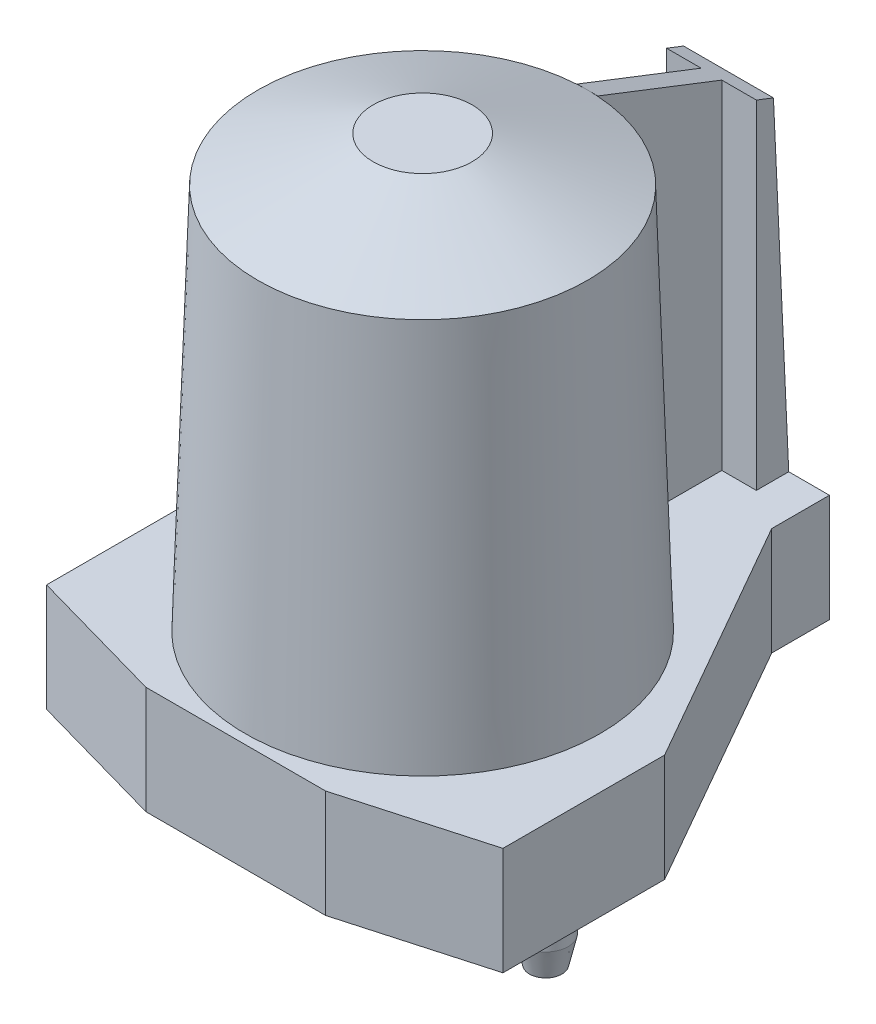
from build123d import *
from OCP.BRepFilletAPI import BRepFilletAPI_MakeChamfer

# Parameters (mm, degrees)
BOSS_EXTRU_1_DEPTH             = 6
BOSS_EXTRU_5_DEPTH             = 0.575
BOSS_EXTRU_6_REACH             = 39.159
ESQUISSE4_W                    = 0.275
ESQUISSE4_H                    = 6
BOSS_EXTRU_6_DIRECTION_2_REACH = 39.159
BOSS_EXTRU_7_DEPTH             = 2.5
ESQUISSE6_R                    = 1.25
BOSS_EXTRU_8_DEPTH             = 2.5
CHANFREIN1_SIZE                = 1.5
CHANFREIN1_SIZE2               = 0.346302287


with BuildPart() as part:
    # Esquisse1 → Boss.-Extru.1 (new body)
    with BuildSketch(Plane(origin=(0, 0, 0), x_dir=(1, 0, 0), z_dir=(0, 1, 0))):
        Polygon((5, -10.4), (-5, -10.4), (-12.7, -8.229746559), (-12.7, 0.770253441), (-4.765, 14.663984942), (-4.765, 17.6), (4.765, 17.6), (4.765, 14.663984942), (12.7, 0.770253441), (12.7, -8.229746559), align=None)
    extrude(amount=BOSS_EXTRU_1_DEPTH)

    # Esquisse2 → Révolution1 (revolve)
    with BuildSketch(Plane(origin=(0, 0, 0), x_dir=(0, 0, -1), z_dir=(1, 0, 0)), mode=Mode.PRIVATE) as r_volution1_sk:
        Polygon((0, 6), (-9.875, 6), (-9.175, 27.5), (-2.75, 30), (0, 30), align=None)
    revolve(r_volution1_sk.sketch.rotate(Axis((0, 30, 0), (0, -1, 0)), 180), axis=Axis((0, 30, 0), (0, -1, 0)))

    # Esquisse3 → Boss.-Extru.5 (add, symmetric)
    with BuildSketch(Plane(origin=(0, 0, 0), x_dir=(0, 0, -1), z_dir=(1, 0, 0))):
        Polygon((9.175, 27.5), (17.024440931, 24.445742828), (17.875, 6), (9.875, 6), (8.375, 6), (8.375, 27.5), align=None)
    extrude(amount=BOSS_EXTRU_5_DEPTH, both=True)

    # Boss.-Extru.6: up to this face of the body (flat: up to its plane)
    boss_extru_6_end = Plane(part.part.faces().sort_by_distance((4.765, 3, -16.131992471))[0])
    # Esquisse4 → Boss.-Extru.6 (add, up to the picked face)
    with BuildSketch(Plane(origin=(0, 0, 0), x_dir=(0, 0, -1), z_dir=(1, 0, 0)), mode=Mode.PRIVATE) as boss_extru_6_sk1:
        with Locations((17.7375, 3)):
            Rectangle(ESQUISSE4_W, ESQUISSE4_H)
    boss_extru_6_tool1 = split(extrude(boss_extru_6_sk1.sketch, amount=BOSS_EXTRU_6_REACH, mode=Mode.PRIVATE), bisect_by=boss_extru_6_end, keep=Keep.BOTH, mode=Mode.PRIVATE)
    add(boss_extru_6_tool1.solids().sort_by(Axis((0, 3, -17.7375), (1, 0, 0)))[0])

    # Boss.-Extru.6 direction 2: up to this face of the body (flat: up to its plane)
    boss_extru_6_direction_2_end = Plane(part.part.faces().sort_by_distance((-4.765, 3, -16.131992471))[0])
    # Esquisse4 → Boss.-Extru.6 direction 2 (add, up to the picked face)
    with BuildSketch(Plane(origin=(0, 0, 0), x_dir=(0, 0, -1), z_dir=(1, 0, 0)), mode=Mode.PRIVATE) as boss_extru_6_direction_2_sk1:
        with Locations((17.7375, 3)):
            Rectangle(ESQUISSE4_W, ESQUISSE4_H)
    boss_extru_6_direction_2_tool1 = split(extrude(boss_extru_6_direction_2_sk1.sketch, amount=-BOSS_EXTRU_6_DIRECTION_2_REACH, mode=Mode.PRIVATE), bisect_by=boss_extru_6_direction_2_end, keep=Keep.BOTH, mode=Mode.PRIVATE)
    add(boss_extru_6_direction_2_tool1.solids().sort_by(Axis((0, 3, -17.7375), (-1, 0, 0)))[0])

    # Esquisse5 → Boss.-Extru.7 (add, symmetric)
    with BuildSketch(Plane(origin=(0, 0, 0), x_dir=(0, 0, -1), z_dir=(1, 0, 0))):
        Polygon((16.074440931, 24.815392634), (17.024440931, 24.445742828), (17.875, 6), (16.074440931, 6), align=None)
    extrude(amount=BOSS_EXTRU_7_DEPTH, both=True)

    # Esquisse6 → Boss.-Extru.8 (add)
    with BuildSketch(Plane.XZ):
        with Locations(Location((-11, 4.15, 0), (0, 0, 270))):
            Circle(ESQUISSE6_R)
        with Locations(Location((11, 4.15, 0), (0, 0, 90))):
            Circle(ESQUISSE6_R)
    extrude(amount=BOSS_EXTRU_8_DEPTH)

    # Chanfrein1: one chamfer whose edges measure the first distance from different faces: ONE call of the kernel's chamfer builder (chamfer() names one face for all edges)
    chanfrein1_edges_1 = [part.edges().sort_by_distance(p)[0] for p in [
        (-11, -2.5, 5.4),
    ]]
    chanfrein1_side_1 = [part.faces().sort_by_distance(p)[0] for p in [
        (-11, -1.25, 5.4),
    ]]
    chanfrein1_edges_2 = [part.edges().sort_by_distance(p)[0] for p in [
        (11, -2.5, 2.9),
    ]]
    chanfrein1_side_2 = [part.faces().sort_by_distance(p)[0] for p in [
        (11, -1.25, 2.9),
    ]]
    chanfrein1 = BRepFilletAPI_MakeChamfer(part.part.solid().wrapped)
    for e in chanfrein1_edges_1:
        chanfrein1.Add(CHANFREIN1_SIZE, CHANFREIN1_SIZE2, e.wrapped, chanfrein1_side_1[0].wrapped)  # the first distance lies on this face
    for e in chanfrein1_edges_2:
        chanfrein1.Add(CHANFREIN1_SIZE, CHANFREIN1_SIZE2, e.wrapped, chanfrein1_side_2[0].wrapped)  # the first distance lies on this face
    add(Compound.cast(chanfrein1.Shape()), mode=Mode.REPLACE)


solid = part.part
